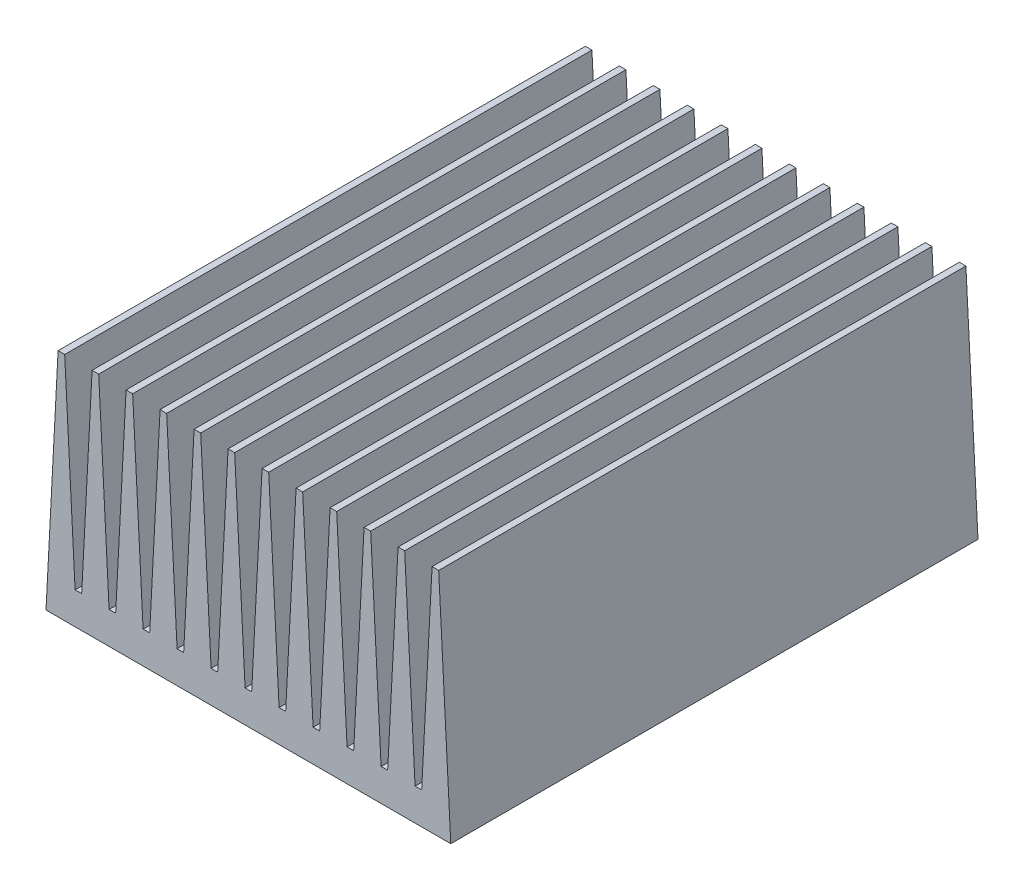
from build123d import *

# Parameters (mm, degrees)
DODANIE_WYCI_GNI_CIE1_DEPTH = 80


with BuildPart() as part:
    # Szkic1 → Dodanie-wyciągnięcie1 (new body)
    with BuildSketch(Plane.XY):
        Polygon((-30.708202586, 0), (30.708202586, 0), (28.873930311, 35), (27.873930311, 35), (26.294482101, 4.862332812), (25.294482101, 4.862332812), (23.715033891, 35), (22.715033891, 35), (21.135585681, 4.862332812), (20.135585681, 4.862332812), (18.556137471, 35), (17.556137471, 35), (15.976689261, 4.862332812), (14.976689261, 4.862332812), (13.39724105, 35), (12.39724105, 35), (10.81779284, 4.862332812), (9.81779284, 4.862332812), (8.23834463, 35), (7.23834463, 35), (5.65889642, 4.862332812), (4.65889642, 4.862332812), (3.07944821, 35), (2.07944821, 35), (0.5, 4.862332812), (-0.5, 4.862332812), (-2.07944821, 35), (-3.07944821, 35), (-4.65889642, 4.862332812), (-5.65889642, 4.862332812), (-7.23834463, 35), (-8.23834463, 35), (-9.81779284, 4.862332812), (-10.81779284, 4.862332812), (-12.39724105, 35), (-13.39724105, 35), (-14.976689261, 4.862332812), (-15.976689261, 4.862332812), (-17.556137471, 35), (-18.556137471, 35), (-20.135585681, 4.862332812), (-21.135585681, 4.862332812), (-22.715033891, 35), (-23.715033891, 35), (-25.294482101, 4.862332812), (-26.294482101, 4.862332812), (-27.873930311, 35), (-28.873930311, 35), (-30.453378521, 4.862332812), align=None)
    extrude(amount=-DODANIE_WYCI_GNI_CIE1_DEPTH)


solid = part.part
